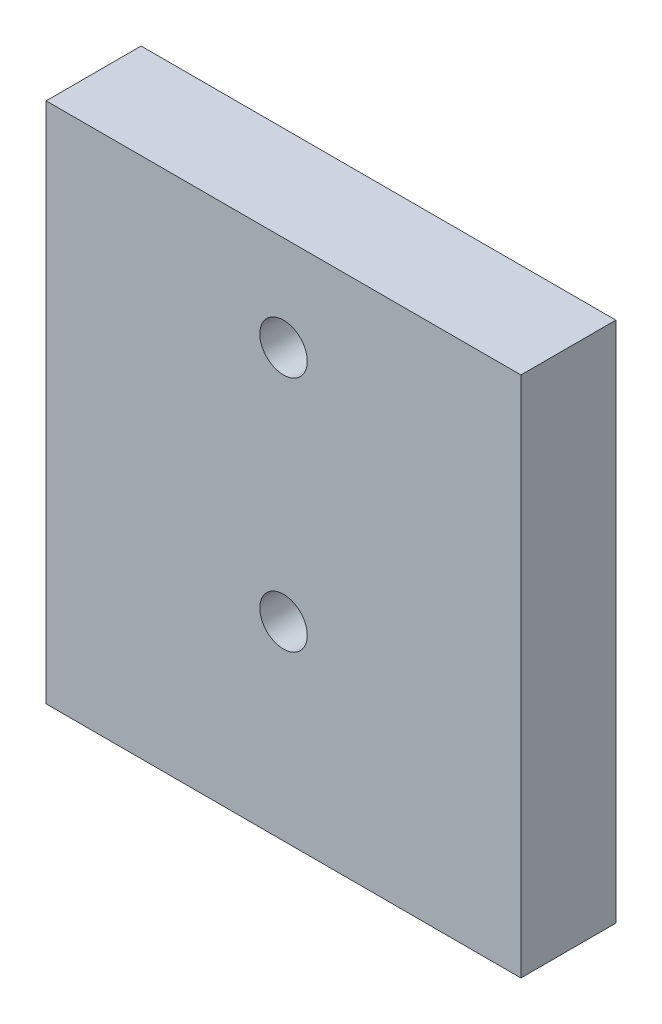
from build123d import *

# Parameters (mm, degrees)
SKETCH_1_W      = 30
SKETCH_1_H      = 33
SKETCH_1_R      = 1.5
EXTRUDE_1_DEPTH = 6


with BuildPart() as part:
    # Эскиз1 → Бобышка-Вытянуть1 (new body)
    with BuildSketch(Plane.XY):
        with Locations((0, 4.5)):
            Rectangle(SKETCH_1_W, SKETCH_1_H)
        Circle(SKETCH_1_R, mode=Mode.SUBTRACT)
        with Locations((0, 15)):
            Circle(SKETCH_1_R, mode=Mode.SUBTRACT)
    extrude(amount=EXTRUDE_1_DEPTH)


solid = part.part
